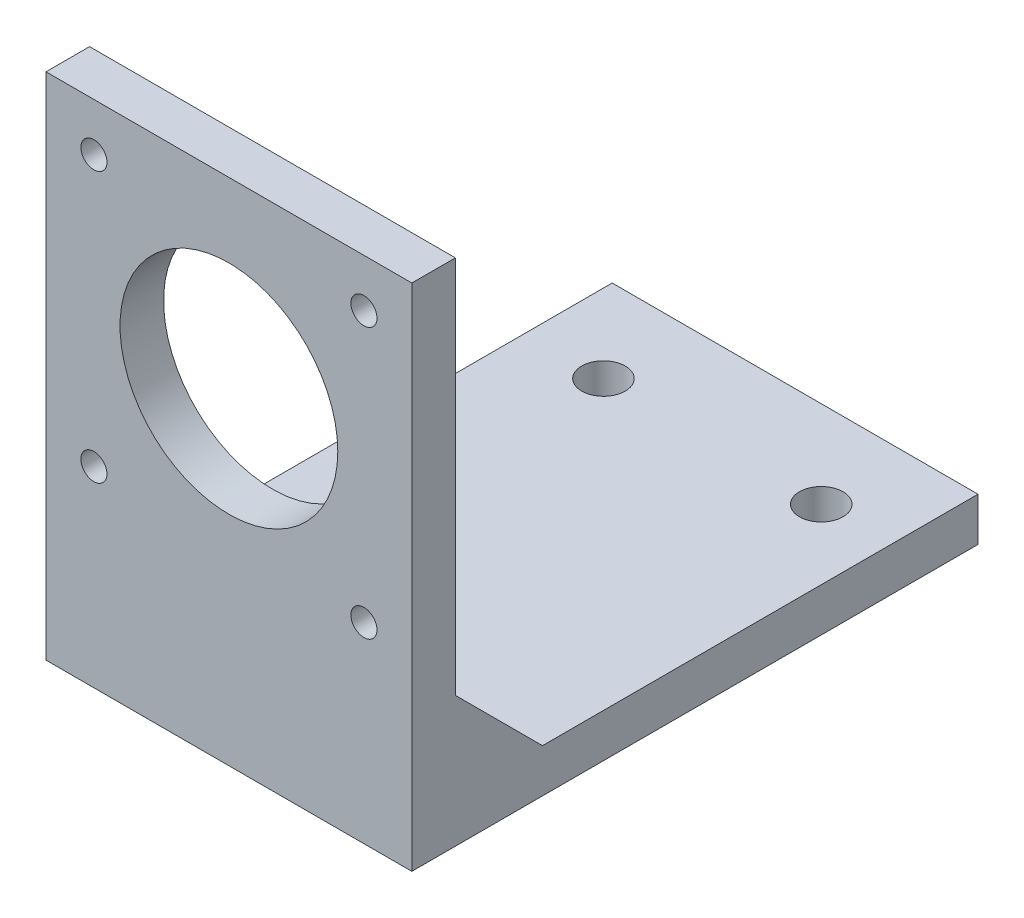
from build123d import *

# Parameters (mm, degrees)
SKETCH_1_W             = 60
SKETCH_1_H             = 42
SKETCH_1_R             = 2.5
EXTRUDE_1_DEPTH        = 5
SKETCH_2_W             = 42
SKETCH_2_H             = 58.5
SKETCH_2_R             = 12.5
SKETCH_2_R_2           = 1.5
EXTRUDE_2_DEPTH        = 5
EXTRUDE_3_DEPTH        = 5
PATTERN_LINEAR_1_COUNT = 2
PATTERN_LINEAR_1_PITCH = 37


with BuildPart() as part:
    # 草图1 → 凸台-拉伸1 (new body)
    with BuildSketch(Plane(origin=(0, 0, 0), x_dir=(0, 0, -1), z_dir=(0, 1, 0))):
        with Locations((-30, 21)):
            Rectangle(SKETCH_1_W, SKETCH_1_H)
        with Locations(Location((-10, 33, 0), (0, 0, 180))):
            Circle(SKETCH_1_R, mode=Mode.SUBTRACT)
        with Locations(Location((-10, 8, 0), (0, 0, 180))):
            Circle(SKETCH_1_R, mode=Mode.SUBTRACT)
    extrude(amount=EXTRUDE_1_DEPTH)

    # 草图2 → 凸台-拉伸2 (add)
    with BuildSketch(Plane.XY.offset(60)):
        with Locations((-21, 29.25)):
            Rectangle(SKETCH_2_W, SKETCH_2_H)
        with Locations((-21, 37.5)):
            Circle(SKETCH_2_R, mode=Mode.SUBTRACT)
        with Locations((-36.5, 53)):
            Circle(SKETCH_2_R_2, mode=Mode.SUBTRACT)
        with Locations((-36.5, 22)):
            Circle(SKETCH_2_R_2, mode=Mode.SUBTRACT)
        with Locations((-5.5, 53)):
            Circle(SKETCH_2_R_2, mode=Mode.SUBTRACT)
        with Locations((-5.5, 22)):
            Circle(SKETCH_2_R_2, mode=Mode.SUBTRACT)
    extrude(amount=EXTRUDE_2_DEPTH)

    # 草图3 → 凸台-拉伸3 (add)
    with BuildSketch(Plane(origin=(0, 0, 0), x_dir=(0, 0, -1), z_dir=(1, 0, 0))):
        Polygon((-60, 15), (-60, 5), (-50, 5), align=None)
    extrude_3 = extrude(amount=-EXTRUDE_3_DEPTH)

    # 阵列(线性)1: 凸台-拉伸3 ×2
    with Locations(*[(-i * PATTERN_LINEAR_1_PITCH, 0, 0) for i in range(1, PATTERN_LINEAR_1_COUNT)]):
        add(extrude_3)


solid = part.part
